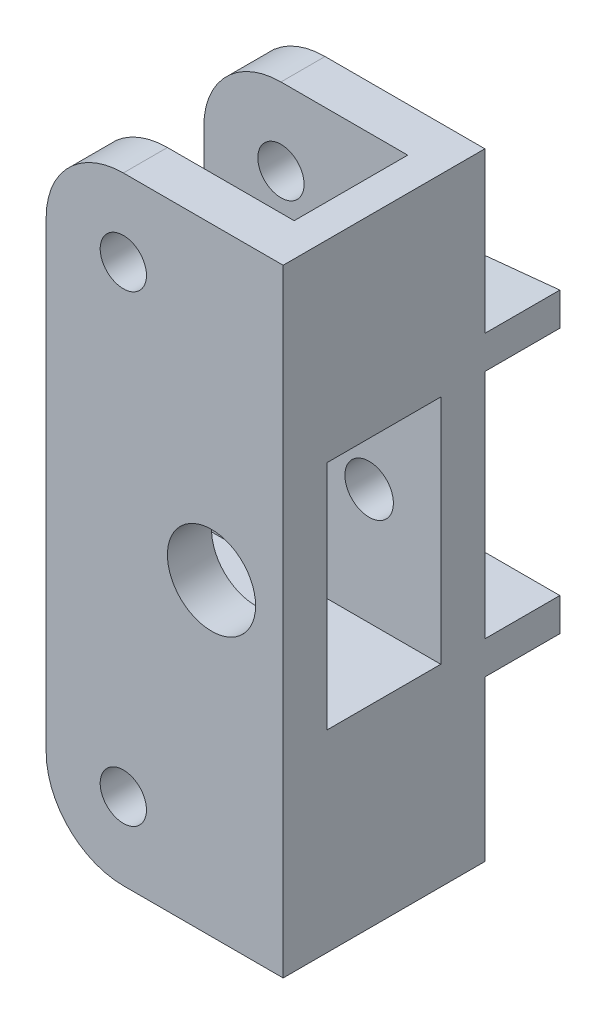
from build123d import *

# Parameters (mm, degrees)
SKETCH_1_R      = 2.1
SKETCH_1_R_2    = 4
EXTRUDE_1_DEPTH = 4
EXTRUDE_2_DEPTH = 10.3
EXTRUDE_START   = -14.3
SKETCH_1_6_R    = 2.1
SKETCH_1_6_R_2  = 2.2
EXTRUDE_3_DEPTH = 4
EXTRUDE_4_DEPTH = 6.8
FILLET_1_R      = 5


with BuildPart() as part:
    # 草图1 → 凸台-拉伸1 (new body)
    with BuildSketch(Plane.XY):
        with BuildLine():
            ThreePointArc((-43, 28), (-47.949747468, 25.949747468), (-50, 21))
            Line((-50, 21), (-50, -21))
            ThreePointArc((-50, -21), (-47.949747468, -25.949747468), (-43, -28))
            Line((-43, -28), (-28.5, -28))
            Line((-28.5, -28), (-28.5, 28))
            Line((-28.5, 28), (-43, 28))
        make_face()
        with Locations((-43, 21)):
            Circle(SKETCH_1_R, mode=Mode.SUBTRACT)
        with Locations((-35, 0)):
            Circle(SKETCH_1_R_2, mode=Mode.SUBTRACT)
        with Locations((-43, -21)):
            Circle(SKETCH_1_R, mode=Mode.SUBTRACT)
    extrude(amount=EXTRUDE_1_DEPTH)

    # 草图1<5> → 凸台-拉伸2 (add)
    with BuildSketch(Plane.XY):
        with BuildLine():
            Line((-43, 12.1), (-50, 12.1))
            Line((-50, 12.1), (-50, 10.5))
            Line((-50, 10.5), (-28.5, 10.5))
            Line((-28.5, 10.5), (-28.5, 28))
            Line((-28.5, 28), (-31.5, 28))
            Line((-31.5, 28), (-34.502137832, 18.354940724))
            ThreePointArc((-34.502137832, 18.354940724), (-37.724160141, 13.832328567), (-43, 12.1))
        make_face()
        with BuildLine():
            Line((-28.5, -10.5), (-50, -10.5))
            Line((-50, -10.5), (-50, -12.1))
            Line((-50, -12.1), (-43, -12.1))
            ThreePointArc((-43, -12.1), (-37.724160141, -13.832328567), (-34.502137832, -18.354940724))
            Line((-34.502137832, -18.354940724), (-31.5, -28))
            Line((-31.5, -28), (-28.5, -28))
            Line((-28.5, -28), (-28.5, -10.5))
        make_face()
    extrude(amount=-EXTRUDE_2_DEPTH)

    # 草图1<6> → 凸台-拉伸3 (add)
    with BuildSketch(Plane.XY.offset(EXTRUDE_START)):
        with BuildLine():
            ThreePointArc((-43, 28), (-47.949747468, 25.949747468), (-50, 21))
            Line((-50, 21), (-50, -21))
            ThreePointArc((-50, -21), (-47.949747468, -25.949747468), (-43, -28))
            Line((-43, -28), (-28.5, -28))
            Line((-28.5, -28), (-28.5, 28))
            Line((-28.5, 28), (-43, 28))
        make_face()
        with Locations((-43, 21)):
            Circle(SKETCH_1_6_R, mode=Mode.SUBTRACT)
        with Locations((-43, -21)):
            Circle(SKETCH_1_6_R, mode=Mode.SUBTRACT)
        with Locations((-35, 0)):
            Circle(SKETCH_1_6_R_2, mode=Mode.SUBTRACT)
    extrude(amount=EXTRUDE_3_DEPTH)

    # 草图1<7> → 凸台-拉伸4 (add)
    with BuildSketch(Plane.XY.offset(EXTRUDE_START)):
        with BuildLine():
            Line((-43, 12.1), (-50, 12.1))
            Line((-50, 12.1), (-50, 10.5))
            Line((-50, 10.5), (-28.5, 10.5))
            Line((-28.5, 10.5), (-28.5, 13.5))
            Line((-28.5, 13.5), (-42.118030123, 12.143808429))
            ThreePointArc((-42.118030123, 12.143808429), (-42.558471393, 12.110958854), (-43, 12.1))
        make_face()
        with BuildLine():
            Line((-28.5, -10.5), (-50, -10.5))
            Line((-50, -10.5), (-50, -12.1))
            Line((-50, -12.1), (-43, -12.1))
            ThreePointArc((-43, -12.1), (-42.558471393, -12.110958854), (-42.118030123, -12.143808429))
            Line((-42.118030123, -12.143808429), (-28.5, -13.5))
            Line((-28.5, -13.5), (-28.5, -10.5))
        make_face()
    extrude(amount=-EXTRUDE_4_DEPTH)

    # 圆角1
    fillet_1_edges = [part.edges().sort_by_distance(p)[0] for p in [
        (-50, 11.3, -21.1),
        (-50, -11.3, -21.1),
    ]]
    fillet(fillet_1_edges, radius=FILLET_1_R)


solid = part.part
